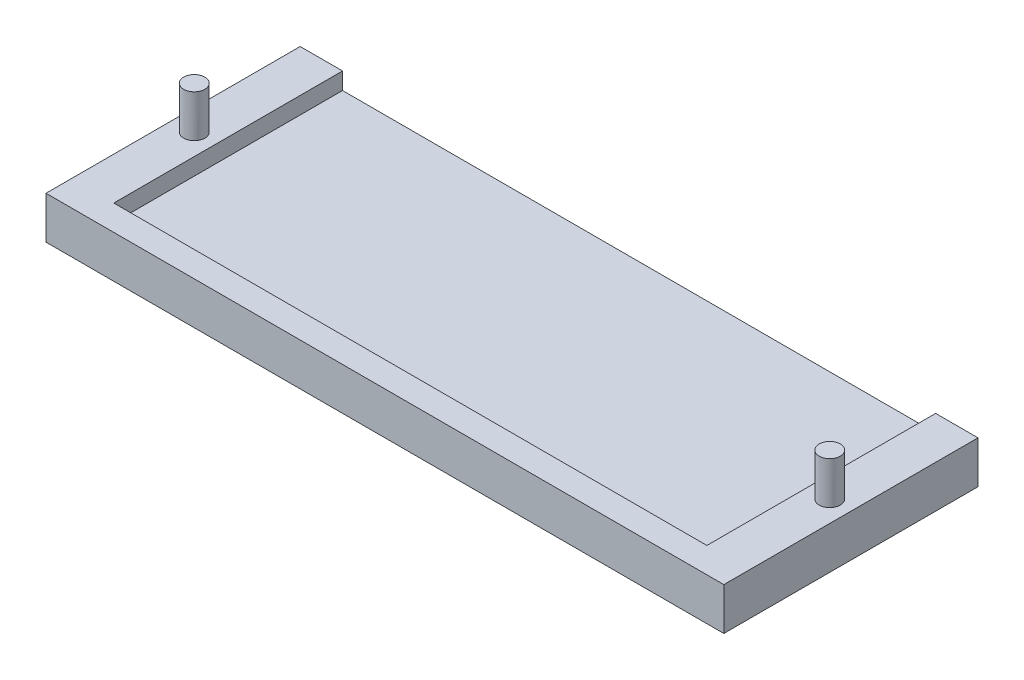
from build123d import *

# Parameters (mm, degrees)
SKETCH1_W           = 203.2
SKETCH1_H           = 76.2
BOSS_EXTRUDE1_DEPTH = 12.7
SKETCH2_W           = 177.8
SKETCH2_H           = 68.58
CUT_EXTRUDE1_DEPTH  = 5.08
SKETCH3_R           = 3.175
BOSS_EXTRUDE3_DEPTH = 12.7
SKETCH4_R           = 3.175
BOSS_EXTRUDE4_DEPTH = 12.7
BOSS_EXTRUDE6_DEPTH = 1.27


with BuildPart() as part:
    # Sketch1 → Boss-Extrude1 (new body)
    with BuildSketch(Plane(origin=(0, 0, 0), x_dir=(1, 0, 0), z_dir=(0, 1, 0))):
        with Locations((55.88, -8.029677419)):
            Rectangle(SKETCH1_W, SKETCH1_H)
    extrude(amount=BOSS_EXTRUDE1_DEPTH)

    # Sketch2 → Cut-Extrude1 (cut)
    with BuildSketch(Plane(origin=(0, 12.7, 0), x_dir=(1, 0, 0), z_dir=(0, 1, 0))):
        with Locations((55.88, -4.219677419)):
            Rectangle(SKETCH2_W, SKETCH2_H)
    extrude(amount=-CUT_EXTRUDE1_DEPTH, mode=Mode.SUBTRACT)

    # Sketch3 → Boss-Extrude3 (add)
    with BuildSketch(Plane(origin=(0, 12.7, 0), x_dir=(1, 0, 0), z_dir=(0, 1, 0))):
        with Locations(Location((151.13, -8.029677419, 0), (0, 0, 90))):
            Circle(SKETCH3_R)
    extrude(amount=BOSS_EXTRUDE3_DEPTH)

    # Sketch4 → Boss-Extrude4 (add)
    with BuildSketch(Plane(origin=(0, 12.7, 0), x_dir=(1, 0, 0), z_dir=(0, 1, 0))):
        with Locations(Location((-39.37, -8.029677419, 0), (0, 0, 90))):
            Circle(SKETCH4_R)
    extrude(amount=BOSS_EXTRUDE4_DEPTH)

    # Sketch5 → Boss-Extrude6 (add)
    # profile 1 of 10: a face of its own
    with BuildSketch(Plane.XZ):
        Polygon((-9.391608291, 14.673853883), (2.91279663, 14.673853883), (2.91279663, 11.331848883), (2.363124755, 11.331848883), (2.003089677, 12.211323883), (-6.033113135, 12.211323883), (-6.033113135, 8.517528883), (0.958713115, 8.517528883), (1.318748193, 9.240347398), (1.868420068, 9.240347398), (1.868420068, 5.312941851), (1.318748193, 5.312941851), (0.958713115, 6.054998883), (-6.033113135, 6.054998883), (-6.033113135, 1.489973961), (-5.291056104, 1.138183961), (-5.291056104, 0.602253883), (-9.391608291, 0.602253883), (-9.391608291, 1.151925758), (-8.671538135, 1.511960836), (-8.671538135, 13.76414693), (-9.391608291, 14.124182008), align=None)
    # profile 2 of 10: a face of its own
    with BuildSketch(Plane.XZ):
        with BuildLine():
            add(Edge.make_bspline(
                [(10.413069365, 11.331848883), (10.640511021, 11.326668092), (11.088681048, 11.316459431), (11.747633576, 11.232746721), (12.380552993, 11.092470155), (12.982853059, 10.896787293), (13.553060922, 10.65806912), (14.083194172, 10.378866385), (14.571405479, 10.059979909), (15.017664278, 9.705722837), (15.420300143, 9.314640191), (15.777703104, 8.888273039), (16.089323392, 8.426597195), (16.355357657, 7.934788131), (16.566775973, 7.41773445), (16.723028893, 6.884162709), (16.815879998, 6.334005388), (16.827426797, 5.961900401), (16.833236865, 5.774666226)],
                knots=[0, 0, 0, 0, 1.155829405, 2.277542752, 3.370080336, 4.446611411, 5.492251174, 6.508814426, 7.48786546, 8.452231681, 9.400669049, 10.336179665, 11.275172522, 12.227363742, 13.17343163, 14.109266722, 15.048629025, 16, 16, 16, 16], degree=3))
            add(Edge.make_bspline(
                [(16.833236865, 5.774666226), (16.827657659, 5.577348483), (16.816722883, 5.190622279), (16.723770392, 4.623949814), (16.569510866, 4.086652281), (16.357518793, 3.578205897), (16.089013103, 3.10568672), (15.776464047, 2.665802058), (15.420533719, 2.259142322), (15.017632087, 1.889792005), (14.570267063, 1.560879909), (14.083541086, 1.265355986), (13.550455427, 1.019052316), (12.98208352, 0.802997091), (12.378783991, 0.63373496), (11.746297641, 0.513083324), (11.088103444, 0.440783673), (10.640448674, 0.431217747), (10.413069365, 0.426358883)],
                knots=[0, 0, 0, 0, 1.012334393, 1.984090384, 2.938117726, 3.876063098, 4.804625699, 5.721891484, 6.641564794, 7.573443468, 8.521460379, 9.487590958, 10.490973842, 11.531178477, 12.605999305, 13.702541846, 14.833041703, 16, 16, 16, 16], degree=3))
            add(Edge.make_bspline(
                [(10.413069365, 0.426358883), (10.191205554, 0.431477248), (9.753740445, 0.441569503), (9.107426807, 0.510659229), (8.482716259, 0.629227045), (7.880877188, 0.792612621), (7.312020238, 1.003374593), (6.778512867, 1.254551462), (6.286720174, 1.547973353), (5.835932308, 1.882607683), (5.427529831, 2.253402869), (5.066427816, 2.663068164), (4.748364531, 3.104238956), (4.477889742, 3.578848061), (4.2577737, 4.085279078), (4.106442936, 4.624423876), (4.008359373, 5.190271158), (3.998122816, 5.577280053), (3.992901865, 5.774666226)],
                knots=[0, 0, 0, 0, 1.139741516, 2.247311734, 3.3346684, 4.403357891, 5.447218542, 6.447208644, 7.42869796, 8.384113234, 9.326914249, 10.257132352, 11.184488605, 12.116169999, 13.058595031, 14.013442126, 14.986795753, 16, 16, 16, 16], degree=3))
            add(Edge.make_bspline(
                [(3.992901865, 5.774666226), (3.997520521, 5.961951501), (4.006697037, 6.334056785), (4.100646435, 6.882199285), (4.238172975, 7.417934952), (4.441429458, 7.933389212), (4.691918664, 8.427527904), (4.996096795, 8.889533927), (5.351034764, 9.314362068), (5.750921228, 9.706451683), (6.197408843, 10.060859878), (6.687105387, 10.377230799), (7.215802114, 10.658933916), (7.786417058, 10.897078004), (8.393116722, 11.093668118), (9.037318114, 11.233380726), (9.714618064, 11.316588774), (10.177389604, 11.326699635), (10.413069365, 11.331848883)],
                knots=[0, 0, 0, 0, 0.94771798, 1.882961004, 2.809240293, 3.745035667, 4.68302571, 5.610919061, 6.540099325, 7.481811997, 8.442717096, 9.422141996, 10.430956701, 11.472843649, 12.549927822, 13.656668207, 14.806590661, 16, 16, 16, 16], degree=3))
        make_face()
        with BuildLine():
            add(Edge.make_bspline(
                [(10.413069365, 9.221108883), (10.268166931, 9.218209819), (9.981971621, 9.212483908), (9.559710787, 9.158841295), (9.151788461, 9.070349745), (8.760422235, 8.951199317), (8.393111732, 8.798840967), (8.049924482, 8.62645141), (7.734885277, 8.427926819), (7.449384846, 8.20518605), (7.19097366, 7.961876763), (6.963579991, 7.697136317), (6.760278356, 7.414931687), (6.588069986, 7.114267409), (6.448387157, 6.798108268), (6.354458663, 6.468551376), (6.289102146, 6.129945372), (6.28275247, 5.89957535), (6.279536865, 5.782911305)],
                knots=[0, 0, 0, 0, 1.164930638, 2.30084255, 3.41645448, 4.518776829, 5.585970288, 6.610712037, 7.604118549, 8.575338206, 9.518658728, 10.453656181, 11.377792066, 12.311743919, 13.235644819, 14.149532719, 15.062885886, 16, 16, 16, 16], degree=3))
            add(Edge.make_bspline(
                [(6.279536865, 5.782911305), (6.282754662, 5.667167796), (6.289083307, 5.439527724), (6.353344058, 5.107878992), (6.448205791, 4.790184071), (6.587540123, 4.490119434), (6.761413575, 4.207844385), (6.963697836, 3.942351737), (7.192392746, 3.694413984), (7.448901809, 3.464491889), (7.736407188, 3.259034317), (8.050379563, 3.073742576), (8.393718526, 2.915530833), (8.761028654, 2.776665523), (9.152626787, 2.671721118), (9.560519871, 2.59481611), (9.982274102, 2.546862961), (10.268196635, 2.540382458), (10.413069365, 2.537098883)],
                knots=[0, 0, 0, 0, 0.949246105, 1.866942306, 2.76396653, 3.666022835, 4.574236592, 5.481421812, 6.402349294, 7.33999045, 8.30449264, 9.299146383, 10.328877642, 11.404722035, 12.5196688, 13.652687845, 14.810651559, 16, 16, 16, 16], degree=3))
            add(Edge.make_bspline(
                [(10.413069365, 2.537098883), (10.557934486, 2.539408683), (10.842863377, 2.543951727), (11.260769253, 2.589487601), (11.661185644, 2.660823052), (12.044486874, 2.758133322), (12.40522387, 2.888858829), (12.74613769, 3.037268675), (13.0572893, 3.21949723), (13.347942018, 3.418096717), (13.608682076, 3.644921858), (13.843599512, 3.890315002), (14.051948793, 4.155117666), (14.227588876, 4.441995002), (14.373831629, 4.748190813), (14.473890992, 5.077028721), (14.53689244, 5.42411687), (14.543321848, 5.661704149), (14.546601865, 5.782911305)],
                knots=[0, 0, 0, 0, 1.185377714, 2.331467755, 3.436111387, 4.512812234, 5.563504784, 6.573846966, 7.551377038, 8.510323401, 9.451364976, 10.374215357, 11.287726611, 12.203420397, 13.122577102, 14.057052877, 15.008789126, 16, 16, 16, 16], degree=3))
            add(Edge.make_bspline(
                [(14.546601865, 5.782911305), (14.543313154, 5.899555119), (14.536819118, 6.129885193), (14.472475478, 6.469043255), (14.374402463, 6.797726085), (14.234869782, 7.113401113), (14.066589462, 7.416582222), (13.859274703, 7.696871838), (13.629678245, 7.962964061), (13.365745817, 8.204352157), (13.07796657, 8.427275833), (12.762539886, 8.626576524), (12.419933208, 8.798223642), (12.055559243, 8.950762362), (11.668924837, 9.07034783), (11.264710646, 9.159401805), (10.844150874, 9.212396694), (10.557966342, 9.218180504), (10.413069365, 9.221108883)],
                knots=[0, 0, 0, 0, 0.937764472, 1.851751508, 2.768381288, 3.692923377, 4.623881193, 5.552968675, 6.493453576, 7.448193188, 8.425914077, 9.420010015, 10.445462936, 11.506580115, 12.595582612, 13.697560662, 14.834260898, 16, 16, 16, 16], degree=3))
        make_face(mode=Mode.SUBTRACT)
    # profile 3 of 10: a face of its own
    with BuildSketch(Plane.XZ):
        with BuildLine():
            add(Edge.make_bspline(
                [(24.660564365, 11.331848883), (24.888006021, 11.326668092), (25.336176048, 11.316459431), (25.995128576, 11.232746721), (26.628047993, 11.092470155), (27.230348059, 10.896787293), (27.800555922, 10.65806912), (28.330689172, 10.378866385), (28.818900479, 10.059979909), (29.265159278, 9.705722837), (29.667795143, 9.314640191), (30.025198104, 8.888273039), (30.336818392, 8.426597195), (30.602852657, 7.934788131), (30.814270973, 7.41773445), (30.970523893, 6.884162709), (31.063374998, 6.334005388), (31.074921797, 5.961900401), (31.080731865, 5.774666226)],
                knots=[0, 0, 0, 0, 1.155829405, 2.277542752, 3.370080336, 4.446611411, 5.492251174, 6.508814426, 7.48786546, 8.452231681, 9.400669049, 10.336179665, 11.275172522, 12.227363742, 13.17343163, 14.109266722, 15.048629025, 16, 16, 16, 16], degree=3))
            add(Edge.make_bspline(
                [(31.080731865, 5.774666226), (31.075152659, 5.577348483), (31.064217883, 5.190622279), (30.971265392, 4.623949814), (30.817005866, 4.086652281), (30.605013793, 3.578205897), (30.336508103, 3.10568672), (30.023959047, 2.665802058), (29.668028719, 2.259142322), (29.265127087, 1.889792005), (28.817762063, 1.560879909), (28.331036086, 1.265355986), (27.797950427, 1.019052316), (27.22957852, 0.802997091), (26.626278991, 0.63373496), (25.993792641, 0.513083324), (25.335598444, 0.440783673), (24.887943674, 0.431217747), (24.660564365, 0.426358883)],
                knots=[0, 0, 0, 0, 1.012334393, 1.984090384, 2.938117726, 3.876063098, 4.804625699, 5.721891484, 6.641564794, 7.573443468, 8.521460379, 9.487590958, 10.490973842, 11.531178477, 12.605999305, 13.702541846, 14.833041703, 16, 16, 16, 16], degree=3))
            add(Edge.make_bspline(
                [(24.660564365, 0.426358883), (24.438700554, 0.431477248), (24.001235445, 0.441569503), (23.354921807, 0.510659229), (22.730211259, 0.629227045), (22.128372188, 0.792612621), (21.559515238, 1.003374593), (21.026007867, 1.254551462), (20.534215174, 1.547973353), (20.083427308, 1.882607683), (19.675024831, 2.253402869), (19.313922816, 2.663068164), (18.995859531, 3.104238956), (18.725384742, 3.578848061), (18.5052687, 4.085279078), (18.353937936, 4.624423876), (18.255854373, 5.190271158), (18.245617816, 5.577280053), (18.240396865, 5.774666226)],
                knots=[0, 0, 0, 0, 1.139741516, 2.247311734, 3.3346684, 4.403357891, 5.447218542, 6.447208644, 7.42869796, 8.384113234, 9.326914249, 10.257132352, 11.184488605, 12.116169999, 13.058595031, 14.013442126, 14.986795753, 16, 16, 16, 16], degree=3))
            add(Edge.make_bspline(
                [(18.240396865, 5.774666226), (18.245015521, 5.961951501), (18.254192037, 6.334056785), (18.348141435, 6.882199285), (18.485667975, 7.417934952), (18.688924458, 7.933389212), (18.939413664, 8.427527904), (19.243591795, 8.889533927), (19.598529764, 9.314362068), (19.998416228, 9.706451683), (20.444903843, 10.060859878), (20.934600387, 10.377230799), (21.463297114, 10.658933916), (22.033912058, 10.897078004), (22.640611722, 11.093668118), (23.284813114, 11.233380726), (23.962113064, 11.316588774), (24.424884604, 11.326699635), (24.660564365, 11.331848883)],
                knots=[0, 0, 0, 0, 0.94771798, 1.882961004, 2.809240293, 3.745035667, 4.68302571, 5.610919061, 6.540099325, 7.481811997, 8.442717096, 9.422141996, 10.430956701, 11.472843649, 12.549927822, 13.656668207, 14.806590661, 16, 16, 16, 16], degree=3))
        make_face()
        with BuildLine():
            add(Edge.make_bspline(
                [(24.660564365, 9.221108883), (24.515661931, 9.218209819), (24.229466621, 9.212483908), (23.807205787, 9.158841295), (23.399283461, 9.070349745), (23.007917235, 8.951199317), (22.640606732, 8.798840967), (22.297419482, 8.62645141), (21.982380277, 8.427926819), (21.696879846, 8.20518605), (21.43846866, 7.961876763), (21.211074991, 7.697136317), (21.007773356, 7.414931687), (20.835564986, 7.114267409), (20.695882157, 6.798108268), (20.601953663, 6.468551376), (20.536597146, 6.129945372), (20.53024747, 5.89957535), (20.527031865, 5.782911305)],
                knots=[0, 0, 0, 0, 1.164930638, 2.30084255, 3.41645448, 4.518776829, 5.585970288, 6.610712037, 7.604118549, 8.575338206, 9.518658728, 10.453656181, 11.377792066, 12.311743919, 13.235644819, 14.149532719, 15.062885886, 16, 16, 16, 16], degree=3))
            add(Edge.make_bspline(
                [(20.527031865, 5.782911305), (20.530249662, 5.667167796), (20.536578307, 5.439527724), (20.600839058, 5.107878992), (20.695700791, 4.790184071), (20.835035123, 4.490119434), (21.008908575, 4.207844385), (21.211192836, 3.942351737), (21.439887746, 3.694413984), (21.696396809, 3.464491889), (21.983902188, 3.259034317), (22.297874563, 3.073742576), (22.641213526, 2.915530833), (23.008523654, 2.776665523), (23.400121787, 2.671721118), (23.808014871, 2.59481611), (24.229769102, 2.546862961), (24.515691635, 2.540382458), (24.660564365, 2.537098883)],
                knots=[0, 0, 0, 0, 0.949246105, 1.866942306, 2.76396653, 3.666022835, 4.574236592, 5.481421812, 6.402349294, 7.33999045, 8.30449264, 9.299146383, 10.328877642, 11.404722035, 12.5196688, 13.652687845, 14.810651559, 16, 16, 16, 16], degree=3))
            add(Edge.make_bspline(
                [(24.660564365, 2.537098883), (24.805429486, 2.539408683), (25.090358377, 2.543951727), (25.508264253, 2.589487601), (25.908680644, 2.660823052), (26.291981874, 2.758133322), (26.65271887, 2.888858829), (26.99363269, 3.037268675), (27.3047843, 3.21949723), (27.595437018, 3.418096717), (27.856177076, 3.644921858), (28.091094512, 3.890315002), (28.299443793, 4.155117666), (28.475083876, 4.441995002), (28.621326629, 4.748190813), (28.721385992, 5.077028721), (28.78438744, 5.42411687), (28.790816848, 5.661704149), (28.794096865, 5.782911305)],
                knots=[0, 0, 0, 0, 1.185377714, 2.331467755, 3.436111387, 4.512812234, 5.563504784, 6.573846966, 7.551377038, 8.510323401, 9.451364976, 10.374215357, 11.287726611, 12.203420397, 13.122577102, 14.057052877, 15.008789126, 16, 16, 16, 16], degree=3))
            add(Edge.make_bspline(
                [(28.794096865, 5.782911305), (28.790808154, 5.899555119), (28.784314118, 6.129885193), (28.719970478, 6.469043255), (28.621897463, 6.797726085), (28.482364782, 7.113401113), (28.314084462, 7.416582222), (28.106769703, 7.696871838), (27.877173245, 7.962964061), (27.613240817, 8.204352157), (27.32546157, 8.427275833), (27.010034886, 8.626576524), (26.667428208, 8.798223642), (26.303054243, 8.950762362), (25.916419837, 9.07034783), (25.512205646, 9.159401805), (25.091645874, 9.212396694), (24.805461342, 9.218180504), (24.660564365, 9.221108883)],
                knots=[0, 0, 0, 0, 0.937764472, 1.851751508, 2.768381288, 3.692923377, 4.623881193, 5.552968675, 6.493453576, 7.448193188, 8.425914077, 9.420010015, 10.445462936, 11.506580115, 12.595582612, 13.697560662, 14.834260898, 16, 16, 16, 16], degree=3))
        make_face(mode=Mode.SUBTRACT)
    # profile 4 of 10: a face of its own
    with BuildSketch(Plane.XZ):
        with BuildLine():
            Line((32.680277021, 11.155953883), (38.105538427, 11.155953883))
            add(Edge.make_bspline(
                [(38.105538427, 11.155953883), (38.366809171, 11.151447611), (38.873063475, 11.142715982), (39.605740025, 11.068841665), (40.286302741, 10.943392637), (40.913661061, 10.766858757), (41.491392745, 10.55106186), (42.014813892, 10.292345886), (42.488236661, 9.997202674), (42.906557826, 9.660834994), (43.275279172, 9.290143782), (43.594294278, 8.885860921), (43.862752245, 8.446972173), (44.074909026, 7.974485275), (44.244711106, 7.4779396), (44.360482698, 6.957038305), (44.434679306, 6.41533251), (44.44401085, 6.047001039), (44.448751865, 5.859865367)],
                knots=[0, 0, 0, 0, 1.33970646, 2.595897855, 3.771733154, 4.884367228, 5.934137673, 6.930106073, 7.873872972, 8.789611672, 9.676660779, 10.549864961, 11.424950493, 12.308008919, 13.20096117, 14.11164778, 15.040597693, 16, 16, 16, 16], degree=3))
            add(Edge.make_bspline(
                [(44.448751865, 5.859865367), (44.443885498, 5.669889685), (44.434289929, 5.295292974), (44.345862655, 4.746215953), (44.206318708, 4.220714952), (44.010668981, 3.721911015), (43.762359874, 3.252824263), (43.4644687, 2.81676979), (43.117735643, 2.415945387), (42.726826849, 2.049447692), (42.289656517, 1.72124426), (41.808698344, 1.431784143), (41.284303416, 1.182697918), (40.720726338, 0.96987719), (40.116795131, 0.806146177), (39.476981506, 0.689017717), (38.802545198, 0.616300683), (38.341167074, 0.607002514), (38.105538427, 0.602253883)],
                knots=[0, 0, 0, 0, 0.984880268, 1.942000703, 2.87690682, 3.800890493, 4.71502009, 5.624542723, 6.534338461, 7.458945213, 8.398958697, 9.364758676, 10.365923195, 11.406608274, 12.485722888, 13.60704199, 14.777901617, 16, 16, 16, 16], degree=3))
            Line((38.105538427, 0.602253883), (32.680277021, 0.602253883))
            Line((32.680277021, 0.602253883), (32.680277021, 1.154674117))
            Line((32.680277021, 1.154674117), (33.191471865, 1.517457555))
            Line((33.191471865, 1.517457555), (33.191471865, 10.240750211))
            Line((33.191471865, 10.240750211), (32.680277021, 10.603533648))
            Line((32.680277021, 10.603533648), (32.680277021, 11.155953883))
        make_face()
        with BuildLine():
            Line((35.478106865, 9.045213883), (35.478106865, 2.712993883))
            Line((35.478106865, 2.712993883), (38.152260537, 2.712993883))
            add(Edge.make_bspline(
                [(38.152260537, 2.712993883), (38.303537798, 2.71537882), (38.598434565, 2.720027967), (39.028768321, 2.763537021), (39.437482331, 2.826515757), (39.821825881, 2.924379707), (40.182838754, 3.042529384), (40.513142972, 3.192292141), (40.815894706, 3.362924662), (41.088866121, 3.55811177), (41.331710573, 3.776954203), (41.546826004, 4.013204078), (41.732267712, 4.267461502), (41.887465229, 4.539158787), (42.012888349, 4.828798487), (42.099818714, 5.138437489), (42.153772243, 5.464950666), (42.159300347, 5.688336678), (42.162116865, 5.80214982)],
                knots=[0, 0, 0, 0, 1.276888896, 2.489140813, 3.648900505, 4.765152793, 5.834090583, 6.851963703, 7.821949074, 8.764307397, 9.679054604, 10.577134146, 11.457483479, 12.330564547, 13.21420403, 14.11521022, 15.039716742, 16, 16, 16, 16], degree=3))
            add(Edge.make_bspline(
                [(42.162116865, 5.80214982), (42.158726644, 5.911317165), (42.152000607, 6.12789998), (42.104935027, 6.447860156), (42.023827831, 6.757658426), (41.914620432, 7.057416065), (41.773807351, 7.343926646), (41.603808185, 7.61581837), (41.396419943, 7.865275128), (41.166961034, 8.10435258), (40.901037623, 8.319092446), (40.603243292, 8.508735413), (40.272694215, 8.672352463), (39.909181279, 8.805460956), (39.51370564, 8.91217509), (39.087717263, 8.993065954), (38.629470694, 9.034643978), (38.314485399, 9.041620704), (38.152260537, 9.045213883)],
                knots=[0, 0, 0, 0, 0.902337112, 1.790193861, 2.666346385, 3.545635269, 4.422834492, 5.301046515, 6.189290749, 7.099695478, 8.036429392, 9.006991244, 10.012867224, 11.079161619, 12.20165957, 13.395849743, 14.658801144, 16, 16, 16, 16], degree=3))
            Line((38.152260537, 9.045213883), (35.478106865, 9.045213883))
        make_face(mode=Mode.SUBTRACT)
    # profile 5 of 10: a face of its own
    with BuildSketch(Plane.XZ):
        Polygon((45.993329834, 0.602253883), (45.993329834, 1.151925758), (46.735386865, 1.511960836), (46.735386865, 13.76414693), (45.993329834, 14.124182008), (45.993329834, 14.673853883), (50.093882021, 14.673853883), (50.093882021, 14.124182008), (49.373811865, 13.76414693), (49.373811865, 3.064783883), (57.256106552, 3.064783883), (57.635380146, 4.147637476), (58.168561865, 4.147637476), (58.168561865, 0.602253883), align=None)
    # profile 6 of 10: a face of its own
    with BuildSketch(Plane.XZ):
        with BuildLine():
            add(Edge.make_bspline(
                [(65.995889365, 11.331848883), (66.223331021, 11.326668092), (66.671501048, 11.316459431), (67.330453576, 11.232746721), (67.963372993, 11.092470155), (68.565673059, 10.896787293), (69.135880922, 10.65806912), (69.666014172, 10.378866385), (70.154225479, 10.059979909), (70.600484278, 9.705722837), (71.003120143, 9.314640191), (71.360523104, 8.888273039), (71.672143392, 8.426597195), (71.938177657, 7.934788131), (72.149595973, 7.41773445), (72.305848893, 6.884162709), (72.398699998, 6.334005388), (72.410246797, 5.961900401), (72.416056865, 5.774666226)],
                knots=[0, 0, 0, 0, 1.155829405, 2.277542752, 3.370080336, 4.446611411, 5.492251174, 6.508814426, 7.48786546, 8.452231681, 9.400669049, 10.336179665, 11.275172522, 12.227363742, 13.17343163, 14.109266722, 15.048629025, 16, 16, 16, 16], degree=3))
            add(Edge.make_bspline(
                [(72.416056865, 5.774666226), (72.410477659, 5.577348483), (72.399542883, 5.190622279), (72.306590392, 4.623949814), (72.152330866, 4.086652281), (71.940338793, 3.578205897), (71.671833103, 3.10568672), (71.359284047, 2.665802058), (71.003353719, 2.259142322), (70.600452087, 1.889792005), (70.153087063, 1.560879909), (69.666361086, 1.265355986), (69.133275427, 1.019052316), (68.56490352, 0.802997091), (67.961603991, 0.63373496), (67.329117641, 0.513083324), (66.670923444, 0.440783673), (66.223268674, 0.431217747), (65.995889365, 0.426358883)],
                knots=[0, 0, 0, 0, 1.012334393, 1.984090384, 2.938117726, 3.876063098, 4.804625699, 5.721891484, 6.641564794, 7.573443468, 8.521460379, 9.487590958, 10.490973842, 11.531178477, 12.605999305, 13.702541846, 14.833041703, 16, 16, 16, 16], degree=3))
            add(Edge.make_bspline(
                [(65.995889365, 0.426358883), (65.774025554, 0.431477248), (65.336560445, 0.441569503), (64.690246807, 0.510659229), (64.065536259, 0.629227045), (63.463697188, 0.792612621), (62.894840238, 1.003374593), (62.361332867, 1.254551462), (61.869540174, 1.547973353), (61.418752308, 1.882607683), (61.010349831, 2.253402869), (60.649247816, 2.663068164), (60.331184531, 3.104238956), (60.060709742, 3.578848061), (59.8405937, 4.085279078), (59.689262936, 4.624423876), (59.591179373, 5.190271158), (59.580942816, 5.577280053), (59.575721865, 5.774666226)],
                knots=[0, 0, 0, 0, 1.139741516, 2.247311734, 3.3346684, 4.403357891, 5.447218542, 6.447208644, 7.42869796, 8.384113234, 9.326914249, 10.257132352, 11.184488605, 12.116169999, 13.058595031, 14.013442126, 14.986795753, 16, 16, 16, 16], degree=3))
            add(Edge.make_bspline(
                [(59.575721865, 5.774666226), (59.580340521, 5.961951501), (59.589517037, 6.334056785), (59.683466435, 6.882199285), (59.820992975, 7.417934952), (60.024249458, 7.933389212), (60.274738664, 8.427527904), (60.578916795, 8.889533927), (60.933854764, 9.314362068), (61.333741228, 9.706451683), (61.780228843, 10.060859878), (62.269925387, 10.377230799), (62.798622114, 10.658933916), (63.369237058, 10.897078004), (63.975936722, 11.093668118), (64.620138114, 11.233380726), (65.297438064, 11.316588774), (65.760209604, 11.326699635), (65.995889365, 11.331848883)],
                knots=[0, 0, 0, 0, 0.94771798, 1.882961004, 2.809240293, 3.745035667, 4.68302571, 5.610919061, 6.540099325, 7.481811997, 8.442717096, 9.422141996, 10.430956701, 11.472843649, 12.549927822, 13.656668207, 14.806590661, 16, 16, 16, 16], degree=3))
        make_face()
        with BuildLine():
            add(Edge.make_bspline(
                [(65.995889365, 9.221108883), (65.850986931, 9.218209819), (65.564791621, 9.212483908), (65.142530787, 9.158841295), (64.734608461, 9.070349745), (64.343242235, 8.951199317), (63.975931732, 8.798840967), (63.632744482, 8.62645141), (63.317705277, 8.427926819), (63.032204846, 8.20518605), (62.77379366, 7.961876763), (62.546399991, 7.697136317), (62.343098356, 7.414931687), (62.170889986, 7.114267409), (62.031207157, 6.798108268), (61.937278663, 6.468551376), (61.871922146, 6.129945372), (61.86557247, 5.89957535), (61.862356865, 5.782911305)],
                knots=[0, 0, 0, 0, 1.164930638, 2.30084255, 3.41645448, 4.518776829, 5.585970288, 6.610712037, 7.604118549, 8.575338206, 9.518658728, 10.453656181, 11.377792066, 12.311743919, 13.235644819, 14.149532719, 15.062885886, 16, 16, 16, 16], degree=3))
            add(Edge.make_bspline(
                [(61.862356865, 5.782911305), (61.865574662, 5.667167796), (61.871903307, 5.439527724), (61.936164058, 5.107878992), (62.031025791, 4.790184071), (62.170360123, 4.490119434), (62.344233575, 4.207844385), (62.546517836, 3.942351737), (62.775212746, 3.694413984), (63.031721809, 3.464491889), (63.319227188, 3.259034317), (63.633199563, 3.073742576), (63.976538526, 2.915530833), (64.343848654, 2.776665523), (64.735446787, 2.671721118), (65.143339871, 2.59481611), (65.565094102, 2.546862961), (65.851016635, 2.540382458), (65.995889365, 2.537098883)],
                knots=[0, 0, 0, 0, 0.949246105, 1.866942306, 2.76396653, 3.666022835, 4.574236592, 5.481421812, 6.402349294, 7.33999045, 8.30449264, 9.299146383, 10.328877642, 11.404722035, 12.5196688, 13.652687845, 14.810651559, 16, 16, 16, 16], degree=3))
            add(Edge.make_bspline(
                [(65.995889365, 2.537098883), (66.140754486, 2.539408683), (66.425683377, 2.543951727), (66.843589253, 2.589487601), (67.244005644, 2.660823052), (67.627306874, 2.758133322), (67.98804387, 2.888858829), (68.32895769, 3.037268675), (68.6401093, 3.21949723), (68.930762018, 3.418096717), (69.191502076, 3.644921858), (69.426419512, 3.890315002), (69.634768793, 4.155117666), (69.810408876, 4.441995002), (69.956651629, 4.748190813), (70.056710992, 5.077028721), (70.11971244, 5.42411687), (70.126141848, 5.661704149), (70.129421865, 5.782911305)],
                knots=[0, 0, 0, 0, 1.185377714, 2.331467755, 3.436111387, 4.512812234, 5.563504784, 6.573846966, 7.551377038, 8.510323401, 9.451364976, 10.374215357, 11.287726611, 12.203420397, 13.122577102, 14.057052877, 15.008789126, 16, 16, 16, 16], degree=3))
            add(Edge.make_bspline(
                [(70.129421865, 5.782911305), (70.126133154, 5.899555119), (70.119639118, 6.129885193), (70.055295478, 6.469043255), (69.957222463, 6.797726085), (69.817689782, 7.113401113), (69.649409462, 7.416582222), (69.442094703, 7.696871838), (69.212498245, 7.962964061), (68.948565817, 8.204352157), (68.66078657, 8.427275833), (68.345359886, 8.626576524), (68.002753208, 8.798223642), (67.638379243, 8.950762362), (67.251744837, 9.07034783), (66.847530646, 9.159401805), (66.426970874, 9.212396694), (66.140786342, 9.218180504), (65.995889365, 9.221108883)],
                knots=[0, 0, 0, 0, 0.937764472, 1.851751508, 2.768381288, 3.692923377, 4.623881193, 5.552968675, 6.493453576, 7.448193188, 8.425914077, 9.420010015, 10.445462936, 11.506580115, 12.595582612, 13.697560662, 14.834260898, 16, 16, 16, 16], degree=3))
        make_face(mode=Mode.SUBTRACT)
    # profile 7 of 10: a face of its own
    with BuildSketch(Plane.XZ):
        with BuildLine():
            add(Edge.make_bspline(
                [(80.325835146, 11.331848883), (80.45870223, 11.330107076), (80.717292745, 11.326717111), (81.094264912, 11.305072783), (81.449468821, 11.267684724), (81.882901474, 11.193875462), (82.379329169, 11.085216764), (82.841997775, 10.950568883), (83.173884759, 10.829540498), (83.396062304, 10.739557043), (83.598816518, 10.646752631), (83.827587776, 10.519113502), (84.070413346, 10.375029106), (84.241235041, 10.247454617), (84.316452959, 10.191279742)],
                knots=[0, 0, 0, 0, 1.13319622, 2.205465677, 3.21932229, 4.177580476, 5.953921896, 7.551008254, 8.28264322, 8.966043103, 9.595258255, 10.182673561, 11.19977664, 12, 12, 12, 12], degree=3))
            Line((84.316452959, 10.191279742), (84.846886318, 10.41939357))
            Line((84.846886318, 10.41939357), (85.283875459, 10.020881461))
            Line((85.283875459, 10.020881461), (83.137406787, 7.453913805))
            Line((83.137406787, 7.453913805), (82.68117913, 7.852425914))
            Line((82.68117913, 7.852425914), (82.81584874, 8.404846148))
            add(Edge.make_bspline(
                [(82.81584874, 8.404846148), (82.712879415, 8.48037833), (82.512885692, 8.627081849), (82.196664491, 8.804196976), (81.88556318, 8.950587178), (81.568761811, 9.056352393), (81.237795223, 9.13032835), (80.88449314, 9.185848542), (80.500367467, 9.214365806), (80.235179172, 9.218806889), (80.097721318, 9.221108883)],
                knots=[0, 0, 0, 0, 1.056862418, 2.052706966, 2.996658355, 3.901359718, 4.812562165, 5.803188582, 6.861303497, 8, 8, 8, 8], degree=3))
            add(Edge.make_bspline(
                [(80.097721318, 9.221108883), (79.954637094, 9.21831904), (79.674793367, 9.212862673), (79.264411772, 9.158933953), (78.873442434, 9.071438406), (78.50237097, 8.949974156), (78.152499946, 8.801036336), (77.824319042, 8.628583477), (77.519815231, 8.428439816), (77.238331577, 8.20709472), (76.979981288, 7.966277238), (76.757729533, 7.699025048), (76.559458956, 7.416081183), (76.399390498, 7.110286088), (76.268008474, 6.79177977), (76.17870146, 6.460062742), (76.121237359, 6.1202033), (76.113662924, 5.890327619), (76.109851865, 5.774666226)],
                knots=[0, 0, 0, 0, 1.171099257, 2.290432677, 3.382358415, 4.447492189, 5.482726386, 6.492786037, 7.478997963, 8.46195213, 9.422407835, 10.364645224, 11.30308259, 12.246066212, 13.1849532, 14.118550981, 15.053353483, 16, 16, 16, 16], degree=3))
            add(Edge.make_bspline(
                [(76.109851865, 5.774666226), (76.113023272, 5.661650391), (76.119259294, 5.439424428), (76.184499073, 5.114430667), (76.278335104, 4.801022971), (76.418224484, 4.504530531), (76.589413047, 4.223805945), (76.78855789, 3.959847559), (77.011509199, 3.710021049), (77.265061484, 3.48169474), (77.547110614, 3.277301648), (77.849820174, 3.087171349), (78.181139413, 2.927508945), (78.532134873, 2.786552114), (78.903207236, 2.673253623), (79.289786456, 2.594925366), (79.689748695, 2.546757152), (79.960166642, 2.540355327), (80.097721318, 2.537098883)],
                knots=[0, 0, 0, 0, 0.951570711, 1.871098134, 2.784800452, 3.704035874, 4.625993042, 5.552854959, 6.488078842, 7.445119563, 8.423002811, 9.421861085, 10.454693105, 11.518931916, 12.608679191, 13.720537963, 14.840496113, 16, 16, 16, 16], degree=3))
            add(Edge.make_bspline(
                [(80.097721318, 2.537098883), (80.285570408, 2.539979846), (80.637826935, 2.545382258), (81.131157339, 2.578102424), (81.553058041, 2.639909597), (81.910084602, 2.724948145), (82.213097719, 2.832538152), (82.476240586, 2.950344682), (82.708844335, 3.075780847), (82.844266085, 3.174187445), (82.909292959, 3.221440367)],
                knots=[0, 0, 0, 0, 1.530000542, 2.869072598, 4.023462491, 4.99885545, 5.853089347, 6.637935066, 7.345963083, 8, 8, 8, 8], degree=3))
            Line((82.909292959, 3.221440367), (82.796610224, 3.828827789))
            Line((82.796610224, 3.828827789), (83.250089521, 4.153134195))
            Line((83.250089521, 4.153134195), (85.380068037, 1.630140289))
            Line((85.380068037, 1.630140289), (84.978807568, 1.278350289))
            Line((84.978807568, 1.278350289), (84.35218163, 1.517457555))
            add(Edge.make_bspline(
                [(84.35218163, 1.517457555), (84.180309754, 1.435165309), (83.847521866, 1.275826487), (83.353379938, 1.05456536), (82.867430713, 0.86199699), (82.376990119, 0.697218866), (81.868415936, 0.569294161), (81.427961332, 0.495449506), (81.055456279, 0.459751944), (80.753815206, 0.442003423), (80.432264338, 0.426220795), (80.211342232, 0.426311984), (80.097721318, 0.426358883)],
                knots=[0, 0, 0, 0, 1.286720858, 2.491420502, 3.655095554, 4.815131102, 5.982401527, 7.192615714, 7.826621679, 8.50846761, 9.232900333, 10, 10, 10, 10], degree=3))
            add(Edge.make_bspline(
                [(80.097721318, 0.426358883), (79.876738199, 0.431164801), (79.440931204, 0.440642688), (78.798651884, 0.514139953), (78.178211007, 0.631560064), (77.583359143, 0.795794211), (77.020556484, 1.002518956), (76.498650333, 1.254298736), (76.017126948, 1.542215836), (75.580865674, 1.87378649), (75.188979403, 2.243751139), (74.840948288, 2.648672697), (74.539470553, 3.090954929), (74.279456716, 3.564881958), (74.076089504, 4.075349647), (73.930725466, 4.614794518), (73.840315413, 5.181652725), (73.828986045, 5.569115842), (73.823216865, 5.766421148)],
                knots=[0, 0, 0, 0, 1.147577063, 2.263168853, 3.353188382, 4.424507993, 5.464860899, 6.463016853, 7.430052485, 8.374139023, 9.303188064, 10.224466595, 11.141767312, 12.078643255, 13.026762401, 13.988315242, 14.975602943, 16, 16, 16, 16], degree=3))
            add(Edge.make_bspline(
                [(73.823216865, 5.766421148), (73.827578089, 5.964565012), (73.836173219, 6.355068228), (73.915839007, 6.928255646), (74.041803209, 7.477640589), (74.21634271, 8.002059657), (74.445965775, 8.493558923), (74.718220656, 8.954432436), (75.041684167, 9.376426319), (75.413791818, 9.762142096), (75.837968609, 10.112540797), (76.322347679, 10.418899676), (76.861996216, 10.689084642), (77.456512648, 10.918358992), (78.102968267, 11.106867208), (78.801846882, 11.235527139), (79.547964492, 11.316690459), (80.061771954, 11.326703064), (80.325835146, 11.331848883)],
                knots=[0, 0, 0, 0, 0.98102092, 1.933402419, 2.860241606, 3.770027652, 4.665371914, 5.542441092, 6.416464575, 7.292594127, 8.192011416, 9.134842402, 10.125180724, 11.176860481, 12.286996777, 13.455546484, 14.692318491, 16, 16, 16, 16], degree=3))
        make_face()
    # profile 8 of 10: a face of its own
    with BuildSketch(Plane.XZ):
        Polygon((87.364383505, 0.602253883), (87.364383505, 1.154674117), (87.894816865, 1.517457555), (87.894816865, 10.221511695), (87.364383505, 10.603533648), (87.364383505, 11.155953883), (90.695395068, 11.155953883), (90.695395068, 10.603533648), (90.181451865, 10.221511695), (90.181451865, 6.755830523), (94.38094499, 10.298465758), (94.075877099, 10.603533648), (94.075877099, 11.155953883), (98.143448974, 11.155953883), (98.143448974, 10.603533648), (97.211755146, 10.240750211), (93.468489677, 7.154342633), (97.857619599, 1.517457555), (98.750836396, 1.154674117), (98.750836396, 0.602253883), (94.589820302, 0.602253883), (94.589820302, 1.09695857), (95.139492177, 1.476232164), (91.987123974, 5.656486773), (90.181451865, 4.268565289), (90.181451865, 1.514709195), (90.695395068, 1.151925758), (90.695395068, 0.602253883), align=None)
    # profile 9 of 10: a face of its own
    with BuildSketch(Plane.XZ):
        Polygon((100.028823505, 11.155953883), (109.249569209, 11.155953883), (109.249569209, 8.245441305), (108.661420302, 8.245441305), (108.394829443, 9.045213883), (102.845891865, 9.045213883), (102.845891865, 7.110368883), (107.61429538, 7.110368883), (107.88088624, 7.643550601), (108.433306474, 7.643550601), (108.433306474, 4.66158068), (107.88088624, 4.66158068), (107.61429538, 5.175523883), (102.845891865, 5.175523883), (102.845891865, 2.712993883), (108.545989209, 2.712993883), (108.831818584, 3.529256617), (109.381490459, 3.529256617), (109.381490459, 0.602253883), (100.028823505, 0.602253883), (100.028823505, 1.154674117), (100.559256865, 1.517457555), (100.559256865, 10.240750211), (100.028823505, 10.603533648), align=None)
    # profile 10 of 10: a face of its own
    with BuildSketch(Plane.XZ):
        with BuildLine():
            Line((111.481237021, 11.155953883), (117.920643037, 11.155953883))
            add(Edge.make_bspline(
                [(117.920643037, 11.155953883), (118.072834554, 11.153724229), (118.368734542, 11.149389201), (118.798620441, 11.104157799), (119.201899115, 11.032993187), (119.579289798, 10.936548588), (119.928648319, 10.804355941), (120.254294278, 10.650647592), (120.550219744, 10.460495803), (120.820401908, 10.247176098), (121.060057598, 10.006521232), (121.270932148, 9.74490246), (121.447173505, 9.458856299), (121.594803565, 9.151840678), (121.706262213, 8.821118518), (121.786488048, 8.468522397), (121.83274961, 8.094599414), (121.839237614, 7.837894711), (121.842551865, 7.706762867)],
                knots=[0, 0, 0, 0, 1.232111207, 2.395545415, 3.495759669, 4.546667155, 5.544376776, 6.516604472, 7.457179353, 8.38642106, 9.299228464, 10.201818289, 11.101476231, 12.014042407, 12.954851334, 13.921315653, 14.938150693, 16, 16, 16, 16], degree=3))
            add(Edge.make_bspline(
                [(121.842551865, 7.706762867), (121.841261783, 7.619647679), (121.838715627, 7.447713683), (121.809891881, 7.19614418), (121.766926674, 6.9540701), (121.70236254, 6.723016741), (121.624132209, 6.499538333), (121.52386529, 6.287928625), (121.408900209, 6.085377248), (121.227384751, 5.833857867), (120.969471258, 5.539801873), (120.60933886, 5.232141456), (120.203972452, 4.962870589), (119.906126965, 4.825355005), (119.75379874, 4.755024898)],
                knots=[0, 0, 0, 0, 0.813765209, 1.606079345, 2.363437399, 3.109090568, 3.845693792, 4.573436732, 5.294501133, 6.019064268, 7.468822697, 8.937943403, 10.433961, 12, 12, 12, 12], degree=3))
            Line((119.75379874, 4.755024898), (122.202586943, 1.517457555))
            Line((122.202586943, 1.517457555), (122.944643974, 1.154674117))
            Line((122.944643974, 1.154674117), (122.944643974, 0.602253883))
            Line((122.944643974, 0.602253883), (119.113431005, 0.602253883))
            Line((119.113431005, 0.602253883), (119.113431005, 1.14093232))
            Line((119.113431005, 1.14093232), (119.380021865, 1.49547068))
            Line((119.380021865, 1.49547068), (117.560607959, 4.120153883))
            Line((117.560607959, 4.120153883), (114.279066865, 4.120153883))
            Line((114.279066865, 4.120153883), (114.279066865, 1.49547068))
            Line((114.279066865, 1.49547068), (114.831487099, 1.14093232))
            Line((114.831487099, 1.14093232), (114.831487099, 0.602253883))
            Line((114.831487099, 0.602253883), (111.481237021, 0.602253883))
            Line((111.481237021, 0.602253883), (111.481237021, 1.154674117))
            Line((111.481237021, 1.154674117), (111.992431865, 1.517457555))
            Line((111.992431865, 1.517457555), (111.992431865, 10.240750211))
            Line((111.992431865, 10.240750211), (111.481237021, 10.603533648))
            Line((111.481237021, 10.603533648), (111.481237021, 11.155953883))
        make_face()
        with BuildLine():
            Line((114.279066865, 9.045213883), (114.279066865, 6.230893883))
            Line((114.279066865, 6.230893883), (117.541369443, 6.230893883))
            add(Edge.make_bspline(
                [(117.541369443, 6.230893883), (117.679056379, 6.234834912), (117.945134199, 6.242450888), (118.326273084, 6.308478381), (118.671777346, 6.418454065), (118.931290228, 6.54683448), (119.113517289, 6.672502088), (119.234024906, 6.776596319), (119.332457094, 6.896927713), (119.417360311, 7.02540511), (119.47600976, 7.169215466), (119.524406168, 7.320264048), (119.552160894, 7.484972681), (119.55463671, 7.598560333), (119.555916865, 7.657292398)],
                knots=[0, 0, 0, 0, 1.783318707, 3.446235125, 4.993050938, 6.469041305, 7.177089553, 7.858355663, 8.524136429, 9.186095718, 9.845495052, 10.528929982, 11.239362907, 12, 12, 12, 12], degree=3))
            add(Edge.make_bspline(
                [(119.555916865, 7.657292398), (119.554549996, 7.71235816), (119.551866415, 7.820469083), (119.524402432, 7.97792085), (119.476035427, 8.123504058), (119.417187116, 8.261832771), (119.332536343, 8.385063677), (119.232190781, 8.499727898), (119.113734124, 8.603800059), (118.931157373, 8.729154187), (118.671825217, 8.857696614), (118.326259005, 8.967616763), (117.945138131, 9.033660402), (117.67905772, 9.041274056), (117.541369443, 9.045213883)],
                knots=[0, 0, 0, 0, 0.722423355, 1.418337896, 2.087665974, 2.733574839, 3.383945995, 4.040072761, 4.730144437, 5.447344418, 6.942412399, 8.509221264, 10.19363137, 12, 12, 12, 12], degree=3))
            Line((117.541369443, 9.045213883), (114.279066865, 9.045213883))
        make_face(mode=Mode.SUBTRACT)
    extrude(amount=BOSS_EXTRUDE6_DEPTH)


solid = part.part
